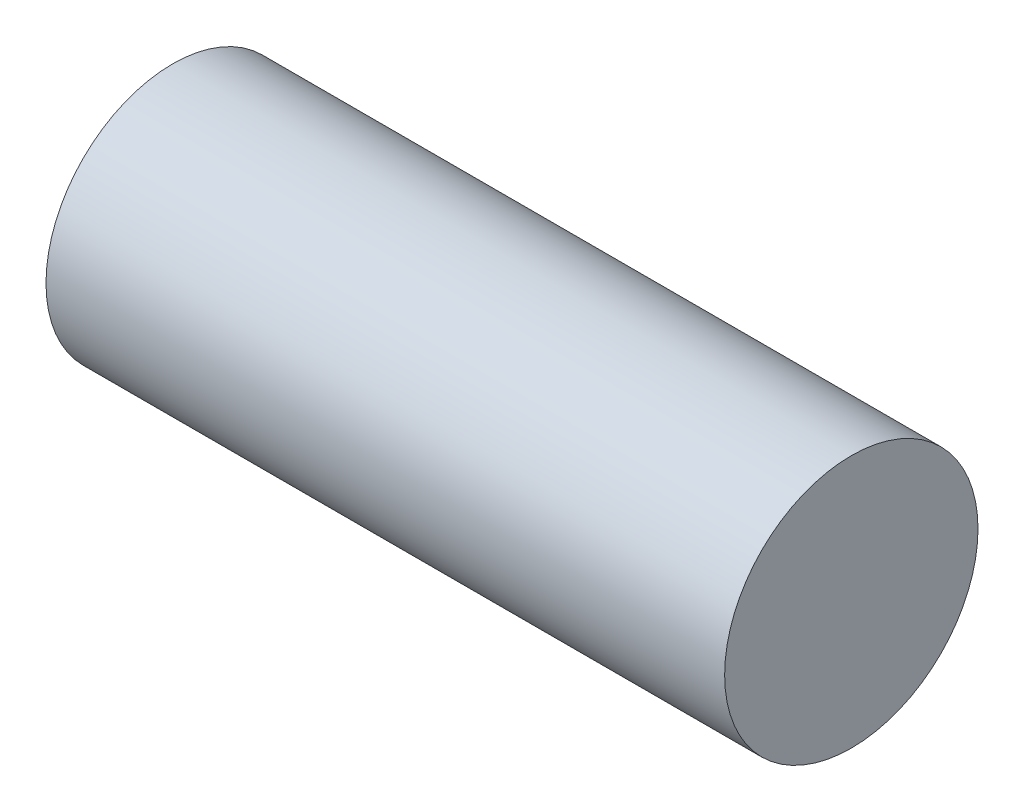
from build123d import *

# Parameters (mm, degrees)
CROQUIS1_R              = 28
SALIENTE_EXTRUIR1_DEPTH = 150


with BuildPart() as part:
    # Croquis1 → Saliente-Extruir1 (new body)
    with BuildSketch(Plane(origin=(0, 0, 0), x_dir=(0, 0, -1), z_dir=(1, 0, 0))):
        Circle(CROQUIS1_R)
    extrude(amount=SALIENTE_EXTRUIR1_DEPTH)


solid = part.part
